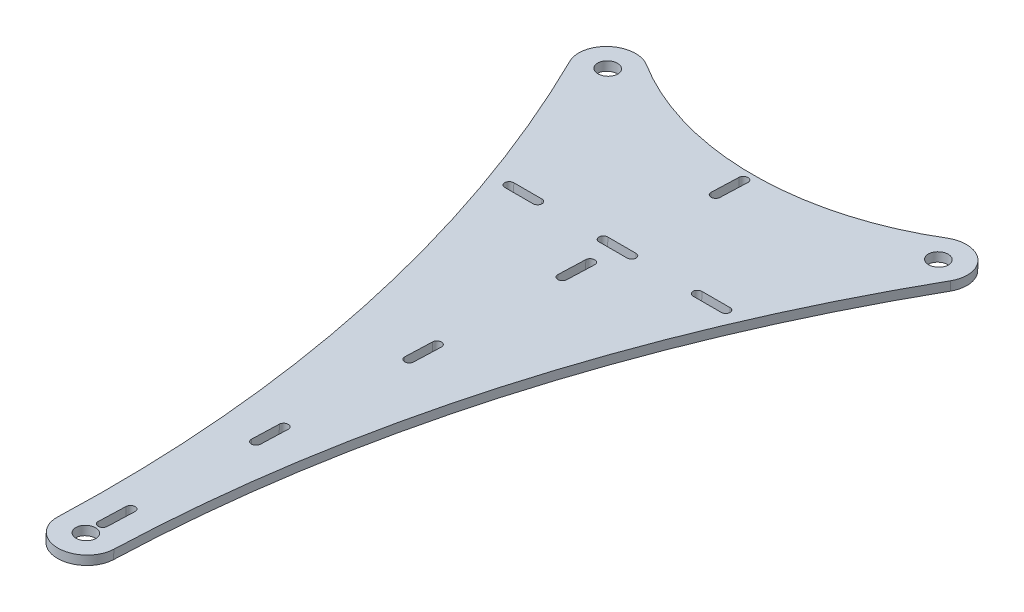
from build123d import *

# Parameters (mm, degrees)
SKETCH1_R           = 10
SKETCH1_R_2         = 3.499999985
SKETCH1_R_3         = 3.5
BOSS_EXTRUDE1_DEPTH = 3.175
CUT_EXTRUDE1_DEPTH  = 3.175


with BuildPart() as part:
    # Sketch1 → Boss-Extrude1 (new body)
    # profile 1 of 4: a face of its own
    with BuildSketch(Plane(origin=(0, 79.166310833, -2.766864901), x_dir=(0, -0.03492870325036397, -0.9993898066766781), z_dir=(0, -0.9993898066766781, 0.03492870325036397))):
        with BuildLine():
            ThreePointArc((-118.870418158, 10), (-111.799350346, 7.071067812), (-108.870418158, 0))
            ThreePointArc((-108.870418158, 0), (-111.799350346, -7.071067812), (-118.870418158, -10))
            ThreePointArc((-118.870418158, -10), (4.966133868, -24.680117915), (121.938173717, -67.906722838))
            ThreePointArc((121.938173717, -67.906722838), (119.088657305, -52.269505992), (134.924502551, -53.636363636))
            ThreePointArc((134.924502551, -53.636363636), (119.323202161, 0), (134.924502551, 53.636363636))
            ThreePointArc((134.924502551, 53.636363636), (119.088657305, 52.269505992), (121.938173717, 67.906722838))
            ThreePointArc((121.938173717, 67.906722838), (4.966133868, 24.680117915), (-118.870418158, 10))
        make_face()
    # profile 2 of 4: a face of its own
    with BuildSketch(Plane(origin=(0, 79.166310833, -2.766864901), x_dir=(0, -0.03492870325036397, -0.9993898066766781), z_dir=(0, -0.9993898066766781, 0.03492870325036397))):
        with Locations((-118.870418158, 0)):
            Circle(SKETCH1_R)
        with Locations((-118.870418158, 0)):
            Circle(SKETCH1_R_2, mode=Mode.SUBTRACT)
    # profile 3 of 4: a face of its own
    with BuildSketch(Plane(origin=(0, 79.166310833, -2.766864901), x_dir=(0, -0.03492870325036397, -0.9993898066766781), z_dir=(0, -0.9993898066766781, 0.03492870325036397))):
        with Locations((126.48463259, 59)):
            Circle(SKETCH1_R)
        with Locations((126.48463259, 59)):
            Circle(SKETCH1_R_3, mode=Mode.SUBTRACT)
    # profile 4 of 4: a face of its own
    with BuildSketch(Plane(origin=(0, 79.166310833, -2.766864901), x_dir=(0, -0.03492870325036397, -0.9993898066766781), z_dir=(0, -0.9993898066766781, 0.03492870325036397))):
        with Locations((126.48463259, -59)):
            Circle(SKETCH1_R)
        with Locations((126.48463259, -59)):
            Circle(SKETCH1_R_3, mode=Mode.SUBTRACT)
    extrude(amount=BOSS_EXTRUDE1_DEPTH)

    # Sketch2 → Cut-Extrude1 (cut)
    with BuildSketch(Plane(origin=(0, 75.993248196, -2.655966268), x_dir=(1, 0, 0), z_dir=(0, -0.9993898066766781, 0.034928703250363964))):
        with BuildLine():
            Line((1.5875, 112.870418158), (1.5875, 102.870418158))
            ThreePointArc((1.5875, 102.870418158), (0, 101.282918158), (-1.5875, 102.870418158))
            Line((-1.5875, 102.870418158), (-1.5875, 112.870418158))
            ThreePointArc((-1.5875, 112.870418158), (0, 114.457918158), (1.5875, 112.870418158))
        make_face()
        with BuildLine():
            Line((1.5875, -105.938173717), (1.5875, -115.938173717))
            ThreePointArc((1.5875, -115.938173717), (0, -117.525673717), (-1.5875, -115.938173717))
            Line((-1.5875, -115.938173717), (-1.5875, -105.938173717))
            ThreePointArc((-1.5875, -105.938173717), (0, -104.350673717), (1.5875, -105.938173717))
        make_face()
        with BuildLine():
            Line((1.5875, 58.168270189), (1.5875, 48.168270189))
            ThreePointArc((1.5875, 48.168270189), (0, 46.580770189), (-1.5875, 48.168270189))
            Line((-1.5875, 48.168270189), (-1.5875, 58.168270189))
            ThreePointArc((-1.5875, 58.168270189), (0, 59.755770189), (1.5875, 58.168270189))
        make_face()
        with BuildLine():
            Line((1.5875, 3.46612222), (1.5875, -6.53387778))
            ThreePointArc((1.5875, -6.53387778), (0, -8.12137778), (-1.5875, -6.53387778))
            Line((-1.5875, -6.53387778), (-1.5875, 3.46612222))
            ThreePointArc((-1.5875, 3.46612222), (0, 5.05362222), (1.5875, 3.46612222))
        make_face()
        with BuildLine():
            Line((1.5875, -51.236025749), (1.5875, -61.236025749))
            ThreePointArc((1.5875, -61.236025749), (0, -62.823525749), (-1.5875, -61.236025749))
            Line((-1.5875, -61.236025749), (-1.5875, -51.236025749))
            ThreePointArc((-1.5875, -51.236025749), (0, -49.648525749), (1.5875, -51.236025749))
        make_face()
        with BuildLine():
            Line((38.57145678, -72.525673717), (28.57145678, -72.525673717))
            ThreePointArc((28.57145678, -72.525673717), (26.98395678, -70.938173717), (28.57145678, -69.350673717))
            Line((28.57145678, -69.350673717), (38.57145678, -69.350673717))
            ThreePointArc((38.57145678, -69.350673717), (40.15895678, -70.938173717), (38.57145678, -72.525673717))
        make_face()
        with BuildLine():
            Line((5, -72.525673717), (-5, -72.525673717))
            ThreePointArc((-5, -72.525673717), (-6.5875, -70.938173717), (-5, -69.350673717))
            Line((-5, -69.350673717), (5, -69.350673717))
            ThreePointArc((5, -69.350673717), (6.5875, -70.938173717), (5, -72.525673717))
        make_face()
        with BuildLine():
            Line((-28.57145678, -72.525673717), (-38.57145678, -72.525673717))
            ThreePointArc((-38.57145678, -72.525673717), (-40.15895678, -70.938173717), (-38.57145678, -69.350673717))
            Line((-38.57145678, -69.350673717), (-28.57145678, -69.350673717))
            ThreePointArc((-28.57145678, -69.350673717), (-26.98395678, -70.938173717), (-28.57145678, -72.525673717))
        make_face()
    extrude(amount=-CUT_EXTRUDE1_DEPTH, mode=Mode.SUBTRACT)


solid = part.part
